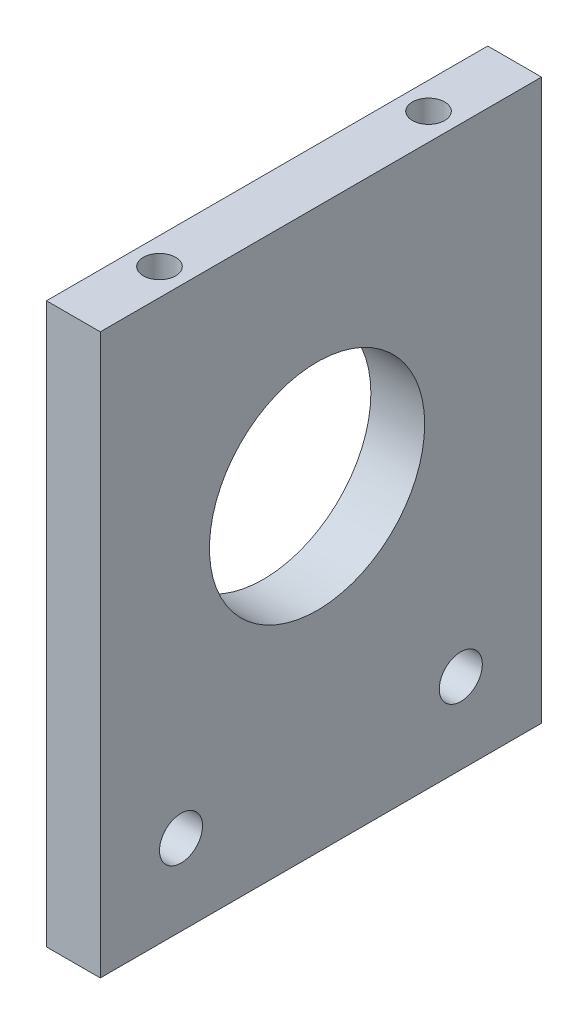
from build123d import *

# Parameters (mm, degrees)
SKETCH1_W           = 41
SKETCH1_H           = 52
SKETCH1_R           = 2
SKETCH1_R_2         = 10
BOSS_EXTRUDE1_DEPTH = 5
SKETCH2_R           = 1.5
CUT_EXTRUDE1_DEPTH  = 7
SKETCH3_R           = 1.5
CUT_EXTRUDE2_DEPTH  = 7


with BuildPart() as part:
    # Sketch1 → Boss-Extrude1 (new body)
    with BuildSketch(Plane(origin=(0, 0, 0), x_dir=(0, 0, -1), z_dir=(1, 0, 0))):
        with Locations((20.5, 26)):
            Rectangle(SKETCH1_W, SKETCH1_H)
        with Locations((7.5, 7.5)):
            Circle(SKETCH1_R, mode=Mode.SUBTRACT)
        with Locations((33.5, 7.5)):
            Circle(SKETCH1_R, mode=Mode.SUBTRACT)
        with Locations((20.143024766, 29.5)):
            Circle(SKETCH1_R_2, mode=Mode.SUBTRACT)
    extrude(amount=BOSS_EXTRUDE1_DEPTH)

    # Sketch2 → Cut-Extrude1 (cut)
    with BuildSketch(Plane(origin=(0, 0, 0), x_dir=(-1, 0, 0), z_dir=(0, -1, 0))):
        with Locations(Location((-2.5, 13, 0), (0, 0, 90))):
            Circle(SKETCH2_R)
        with Locations(Location((-2.5, 28, 0), (0, 0, 90))):
            Circle(SKETCH2_R)
    extrude(amount=-CUT_EXTRUDE1_DEPTH, mode=Mode.SUBTRACT)

    # Sketch3 → Cut-Extrude2 (cut)
    with BuildSketch(Plane(origin=(0, 52, 0), x_dir=(1, 0, 0), z_dir=(0, 1, 0))):
        with Locations(Location((2.5, 8, 0), (0, 0, 270))):
            Circle(SKETCH3_R)
        with Locations(Location((2.5, 33, 0), (0, 0, 270))):
            Circle(SKETCH3_R)
    extrude(amount=-CUT_EXTRUDE2_DEPTH, mode=Mode.SUBTRACT)


solid = part.part
